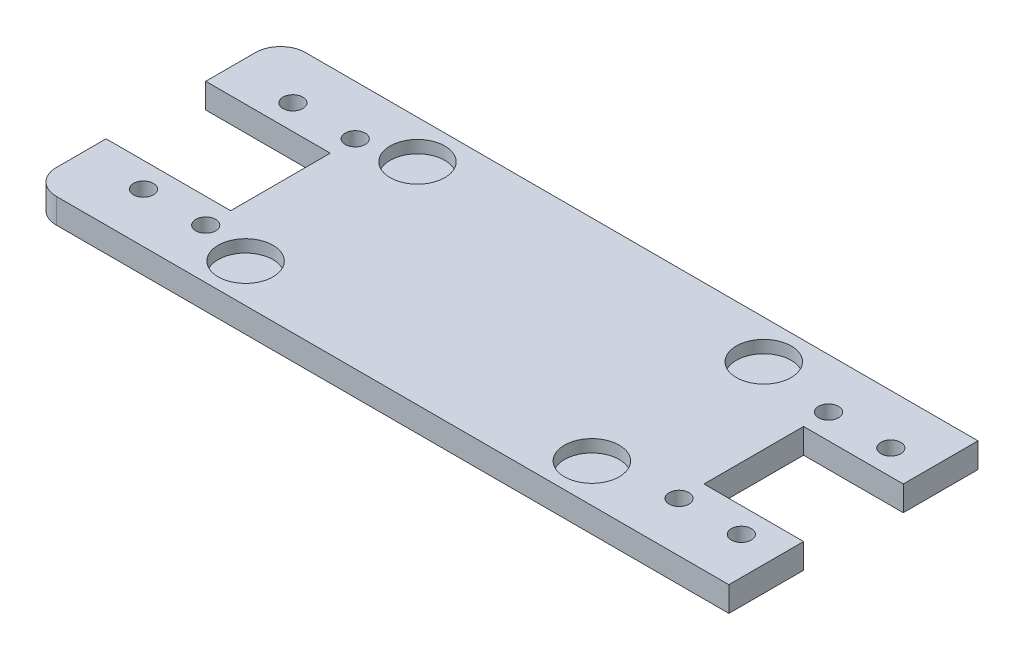
from build123d import *

# Parameters (mm, degrees)
SKETCH_3_W          = 280
SKETCH_3_H          = 100
EXTRUDE_1_DEPTH     = 10
SKETCH_5_R          = 4
CUT_EXTRUDE_1_DEPTH = 149.996644258
SKETCH_6_R          = 4
CUT_EXTRUDE_2_DEPTH = 10
SKETCH_7_W          = 50
SKETCH_7_H          = 40
CUT_EXTRUDE_3_DEPTH = 149.996644258
FILLET_1_R          = 10
FILLET_2_R          = 10
SKETCH_8_W          = 40
SKETCH_8_H          = 40
CUT_EXTRUDE_4_DEPTH = 149.996644258
SKETCH_11_R         = 11
CUT_EXTRUDE_5_DEPTH = 5


with BuildPart() as part:
    # 草图3 → 凸台-拉伸1 (new body)
    with BuildSketch(Plane(origin=(0, 0, 0), x_dir=(1, 0, 0), z_dir=(0, 1, 0))):
        Rectangle(SKETCH_3_W, SKETCH_3_H)
    extrude(amount=EXTRUDE_1_DEPTH)

    # 草图5 → 切除-拉伸1 (cut, through all)
    with BuildSketch(Plane(origin=(0, 10, 0), x_dir=(1, 0, 0), z_dir=(0, 1, 0))):
        with Locations(Location((-115, -30, 0), (0, 0, 270))):
            Circle(SKETCH_5_R)
        with Locations(Location((-90, -30, 0), (0, 0, 270))):
            Circle(SKETCH_5_R)
    cut_extrude_1 = extrude(amount=-CUT_EXTRUDE_1_DEPTH, mode=Mode.SUBTRACT)

    # 镜向1: 切除-拉伸1 across plane
    add(cut_extrude_1.mirror(Plane.XY), mode=Mode.SUBTRACT)

    # 草图6 → 切除-拉伸2 (cut)
    with BuildSketch(Plane(origin=(0, 10, 0), x_dir=(1, 0, 0), z_dir=(0, 1, 0))):
        with Locations(Location((125, 30, 0), (0, 0, 270))):
            Circle(SKETCH_6_R)
        with Locations(Location((100, 30, 0), (0, 0, 270))):
            Circle(SKETCH_6_R)
    cut_extrude_2 = extrude(amount=-CUT_EXTRUDE_2_DEPTH, mode=Mode.SUBTRACT)

    # 镜向2: 切除-拉伸2 across plane
    add(cut_extrude_2.mirror(Plane.XY), mode=Mode.SUBTRACT)

    # 草图7 → 切除-拉伸3 (cut, through all)
    with BuildSketch(Plane(origin=(0, 10, 0), x_dir=(1, 0, 0), z_dir=(0, 1, 0))):
        with Locations((-115, 0)):
            Rectangle(SKETCH_7_W, SKETCH_7_H)
    extrude(amount=-CUT_EXTRUDE_3_DEPTH, mode=Mode.SUBTRACT)

    # 圆角1
    fillet_1_edges = [part.edges().sort_by_distance(p)[0] for p in [
        (-140, 5, 50),
    ]]
    fillet(fillet_1_edges, radius=FILLET_1_R)

    # 圆角2
    fillet_2_edges = [part.edges().sort_by_distance(p)[0] for p in [
        (-140, 5, -50),
    ]]
    fillet(fillet_2_edges, radius=FILLET_2_R)

    # 草图8 → 切除-拉伸4 (cut, through all)
    with BuildSketch(Plane(origin=(0, 10, 0), x_dir=(1, 0, 0), z_dir=(0, 1, 0))):
        with Locations((120, 0)):
            Rectangle(SKETCH_8_W, SKETCH_8_H)
    extrude(amount=-CUT_EXTRUDE_4_DEPTH, mode=Mode.SUBTRACT)

    # 草图11 → 切除-拉伸5 (cut)
    with BuildSketch(Plane(origin=(0, 10, 0), x_dir=(1, 0, 0), z_dir=(0, 1, 0))):
        with Locations(Location((-69.5, -34.5, 0), (0, 0, 270))):
            Circle(SKETCH_11_R)
        with Locations(Location((-69.5, 34.5, 0), (0, 0, 270))):
            Circle(SKETCH_11_R)
        with Locations(Location((69.5, 34.5, 0), (0, 0, 270))):
            Circle(SKETCH_11_R)
        with Locations(Location((69.5, -34.5, 0), (0, 0, 270))):
            Circle(SKETCH_11_R)
    extrude(amount=-CUT_EXTRUDE_5_DEPTH, mode=Mode.SUBTRACT)


solid = part.part
